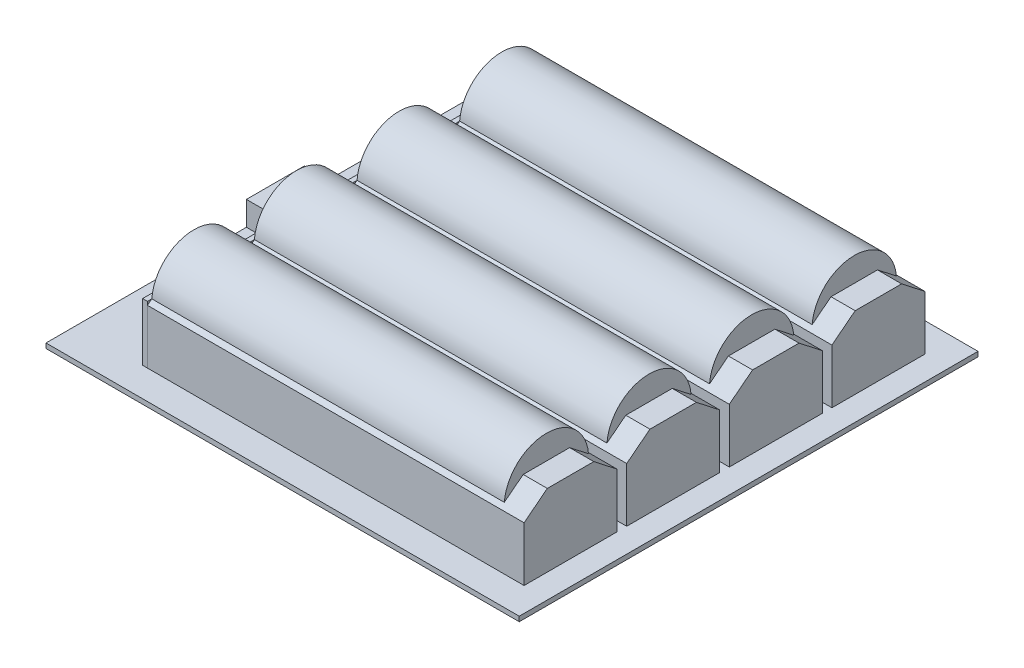
from build123d import *

# Parameters (mm, degrees)
SKETCH_1_W          = 98
SKETCH_1_H          = 95
EXTRUDE_1_DEPTH     = 1
SKETCH_2_W          = 78
SKETCH_2_H          = 85
EXTRUDE_2_DEPTH     = 20
CUT_EXTRUDE_1_DEPTH = 100
CUT_EXTRUDE_2_DEPTH = 5
SKETCH_5_W          = 9
SKETCH_5_H          = 12
EXTRUDE_3_DEPTH     = 5
SKETCH_6_W          = 11.2
SKETCH_6_H          = 4.6
SKETCH_6_W_2        = 10.2
SKETCH_6_H_2        = 1.749108458
CUT_EXTRUDE_4_DEPTH = 8
CUT_EXTRUDE_5_DEPTH = 0.5
SKETCH_8_W          = 83
SKETCH_8_H          = 11.962724137
EXTRUDE_4_DEPTH     = 1


with BuildPart() as part:
    # 스케치1 → 보스-돌출1 (new body)
    with BuildSketch(Plane(origin=(0, 0, 0), x_dir=(1, 0, 0), z_dir=(0, 1, 0))):
        Rectangle(SKETCH_1_W, SKETCH_1_H)
    extrude(amount=EXTRUDE_1_DEPTH)

    # 스케치2 → 보스-돌출2 (add)
    with BuildSketch(Plane(origin=(0, 1, 0), x_dir=(1, 0, 0), z_dir=(0, 1, 0))):
        with Locations((5, 0)):
            Rectangle(SKETCH_2_W, SKETCH_2_H)
    extrude(amount=EXTRUDE_2_DEPTH)

    # 스케치4 → 컷-돌출1 (cut)
    with BuildSketch(Plane(origin=(44, 0, 0), x_dir=(0, 0, -1), z_dir=(1, 0, 0))):
        with BuildLine():
            Line((-42.5, 1), (-41.5, 1))
            Line((-41.5, 1), (-41.5, 12.254740451))
            Line((-41.5, 12.254740451), (-40.591554577, 12.962724137))
            ThreePointArc((-40.591554577, 12.962724137), (-37.80324019, 18.684012014), (-31.875, 21))
            Line((-31.875, 21), (-42.5, 21))
            Line((-42.5, 21), (-42.5, 1))
        make_face()
        with BuildLine():
            Line((-22.25, 12.254740451), (-22.25, 1))
            Line((-22.25, 1), (-20.25, 1))
            Line((-20.25, 1), (-20.25, 12.254740451))
            Line((-20.25, 12.254740451), (-19.341554577, 12.962724137))
            ThreePointArc((-19.341554577, 12.962724137), (-16.553240185, 18.684012019), (-10.624999986, 21))
            Line((-10.624999986, 21), (-31.875, 21))
            ThreePointArc((-31.875, 21), (-25.94675981, 18.684012014), (-23.158445423, 12.962724137))
            Line((-23.158445423, 12.962724137), (-22.25, 12.254740451))
        make_face()
        with BuildLine():
            Line((-1, 12.254740451), (-1, 1))
            Line((-1, 1), (1, 1))
            Line((1, 1), (1, 12.254740451))
            Line((1, 12.254740451), (1.908445423, 12.962724137))
            ThreePointArc((1.908445423, 12.962724137), (4.696759796, 18.684012001), (10.62499996, 21))
            Line((10.62499996, 21), (-10.624999986, 21))
            ThreePointArc((-10.624999986, 21), (-4.696759805, 18.68401201), (-1.908445423, 12.962724137))
            Line((-1.908445423, 12.962724137), (-1, 12.254740451))
        make_face()
        with BuildLine():
            Line((20.25, 12.254740451), (20.25, 1))
            Line((20.25, 1), (22.25, 1))
            Line((22.25, 1), (22.25, 12.254740451))
            Line((22.25, 12.254740451), (23.158445423, 12.962724137))
            ThreePointArc((23.158445423, 12.962724137), (25.94675981, 18.684012014), (31.875, 21))
            Line((31.875, 21), (10.62499996, 21))
            ThreePointArc((10.62499996, 21), (16.553240175, 18.684012028), (19.341554577, 12.962724137))
            Line((19.341554577, 12.962724137), (20.25, 12.254740451))
        make_face()
        with BuildLine():
            Line((42.5, 21), (31.875, 21))
            ThreePointArc((31.875, 21), (37.80324019, 18.684012014), (40.591554577, 12.962724137))
            Line((40.591554577, 12.962724137), (41.5, 12.254740451))
            Line((41.5, 12.254740451), (41.5, 1))
            Line((41.5, 1), (42.5, 1))
            Line((42.5, 1), (42.5, 21))
        make_face()
    extrude(amount=-CUT_EXTRUDE_1_DEPTH, mode=Mode.SUBTRACT)

    # 스케치4<3> → 컷-돌출2 (cut)
    with BuildSketch(Plane(origin=(44, 0, 0), x_dir=(0, 0, -1), z_dir=(1, 0, 0))):
        with BuildLine():
            ThreePointArc((-23.158445423, 12.962724137), (-31.875, 21), (-40.591554577, 12.962724137))
            Line((-40.591554577, 12.962724137), (-36.685, 16.007240451))
            Line((-36.685, 16.007240451), (-27.065, 16.007240451))
            Line((-27.065, 16.007240451), (-23.158445423, 12.962724137))
        make_face()
        with BuildLine():
            Line((-5.815, 16.007240451), (-1.908445423, 12.962724137))
            ThreePointArc((-1.908445423, 12.962724137), (-10.625, 21), (-19.341554577, 12.962724137))
            Line((-19.341554577, 12.962724137), (-15.435, 16.007240451))
            Line((-15.435, 16.007240451), (-5.815, 16.007240451))
        make_face()
        with BuildLine():
            Line((36.685, 16.007240451), (40.591554577, 12.962724137))
            ThreePointArc((40.591554577, 12.962724137), (31.875, 21), (23.158445423, 12.962724137))
            Line((23.158445423, 12.962724137), (27.065, 16.007240451))
            Line((27.065, 16.007240451), (36.685, 16.007240451))
        make_face()
        with BuildLine():
            Line((15.435, 16.007240451), (19.341554577, 12.962724137))
            ThreePointArc((19.341554577, 12.962724137), (10.625, 21), (1.908445423, 12.962724137))
            Line((1.908445423, 12.962724137), (5.815, 16.007240451))
            Line((5.815, 16.007240451), (15.435, 16.007240451))
        make_face()
    extrude(amount=-CUT_EXTRUDE_2_DEPTH, mode=Mode.SUBTRACT)

    # 스케치5 → 보스-돌출3 (add)
    with BuildSketch(Plane(origin=(0, 1, 0), x_dir=(1, 0, 0), z_dir=(0, 1, 0))):
        with Locations((-44.5, 0)):
            Rectangle(SKETCH_5_W, SKETCH_5_H)
    extrude(amount=EXTRUDE_3_DEPTH)

    # 스케치6 → 컷-돌출4 (cut)
    with BuildSketch(Plane.ZY.offset(49)):
        with Locations((0, 3.3)):
            Rectangle(SKETCH_6_W, SKETCH_6_H)
        with Locations((0, 4.300145796)):
            Rectangle(SKETCH_6_W_2, SKETCH_6_H_2, mode=Mode.SUBTRACT)
    extrude(amount=-CUT_EXTRUDE_4_DEPTH, mode=Mode.SUBTRACT)

    # 스케치7 → 컷-돌출5 (cut)
    with BuildSketch(Plane(origin=(0, 6, 0), x_dir=(1, 0, 0), z_dir=(0, 1, 0))):
        Polygon((-42.731367286, 2.836850655), (-46.283445156, 2.836850655), (-47.255371975, 2.487236692), (-47.255371975, 1.305541495), (-46.33938339, 0.68322864), (-42.731367286, 0.68322864), (-42.731367286, 0.994385067), (-46.33938339, 0.994385067), (-46.960091467, 1.416087501), (-46.960091467, 2.396337061), (-46.33938339, 2.619613348), (-42.731367286, 2.619613348), align=None)
        Polygon((-42.731367286, -2.836850655), (-46.283445156, -2.836850655), (-47.255371975, -2.487236692), (-47.255371975, -1.305541495), (-46.33938339, -0.68322864), (-42.731367286, -0.68322864), (-42.731367286, -0.994385067), (-46.33938339, -0.994385067), (-46.960091467, -1.416087501), (-46.960091467, -2.396337061), (-46.33938339, -2.619613348), (-42.731367286, -2.619613348), align=None)
    extrude(amount=-CUT_EXTRUDE_5_DEPTH, mode=Mode.SUBTRACT)


with BuildPart() as body_2:
    # 스케치8 → 보스-돌출4 (new body)
    with BuildSketch(Plane.ZY.offset(34)):
        with Locations((0, 6.981362069)):
            Rectangle(SKETCH_8_W, SKETCH_8_H)
    extrude(amount=EXTRUDE_4_DEPTH)


solid = Compound([part.part, body_2.part])
